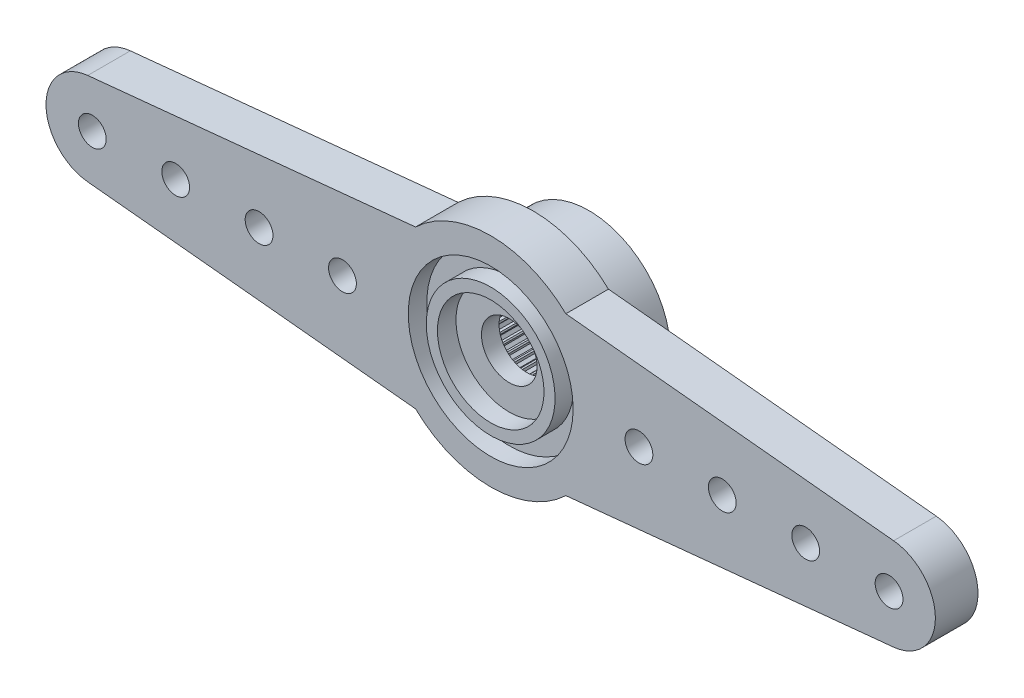
from build123d import *

# Parameters (mm, degrees)
BOSS_EXTRU_1_DEPTH      = 2.3
ESQUISSE2_R             = 4.45
ENL_V_MAT_EXTRU_1_DEPTH = 1
ESQUISSE3_R             = 3.475
ESQUISSE3_R_2           = 2.875
BOSS_EXTRU_2_DEPTH      = 1
ESQUISSE4_R             = 4.4
BOSS_EXTRU_3_DEPTH      = 3
ESQUISSE5_R             = 1.5
ENL_V_MAT_EXTRU_2_DEPTH = 26.079984549
ENL_V_START             = -3.35
ESQUISSE6_R             = 1.5
ENL_V_MAT_EXTRU_3_DEPTH = 3.35
ESQUISSE7_R             = 0.75
ENL_V_MAT_EXTRU_4_DEPTH = 3.35


with BuildPart() as part:
    # Esquisse1 → Boss.-Extru.1 (new body)
    with BuildSketch(Plane.XY):
        with BuildLine():
            Line((-21.747806415, 2.487688079), (-4.056245185, 4.25))
            ThreePointArc((-4.056245185, 4.25), (0, 5.875), (4.056245185, 4.25))
            Line((4.056245185, 4.25), (21.747806415, 2.487688079))
            ThreePointArc((21.747806415, 2.487688079), (24, 0), (21.747806415, -2.487688079))
            Line((21.747806415, -2.487688079), (4.056245185, -4.25))
            ThreePointArc((4.056245185, -4.25), (0, -5.875), (-4.056245185, -4.25))
            Line((-4.056245185, -4.25), (-21.747806415, -2.487688079))
            ThreePointArc((-21.747806415, -2.487688079), (-24, 0), (-21.747806415, 2.487688079))
        make_face()
    extrude(amount=BOSS_EXTRU_1_DEPTH)

    # Esquisse2 → Enlèv. mat.-Extru.1 (cut)
    with BuildSketch(Plane.XY.offset(2.3)):
        Circle(ESQUISSE2_R)
    extrude(amount=-ENL_V_MAT_EXTRU_1_DEPTH, mode=Mode.SUBTRACT)

    # Esquisse3 → Boss.-Extru.2 (add)
    with BuildSketch(Plane.XY.offset(1.3)):
        with Locations(Location((0, 0, 0), (0, 0, 180))):
            Circle(ESQUISSE3_R)
        with Locations(Location((0, 0, 0), (0, 0, 180))):
            Circle(ESQUISSE3_R_2, mode=Mode.SUBTRACT)
    extrude(amount=BOSS_EXTRU_2_DEPTH)

    # Esquisse4 → Boss.-Extru.3 (add)
    with BuildSketch(Plane(origin=(0, 0, 0), x_dir=(-1, 0, 0), z_dir=(0, 0, -1))):
        Circle(ESQUISSE4_R)
    extrude(amount=BOSS_EXTRU_3_DEPTH)

    # Esquisse5 → Enlèv. mat.-Extru.2 (cut, through all)
    with BuildSketch(Plane.XY.offset(1.3)):
        Circle(ESQUISSE5_R)
    extrude(amount=-ENL_V_MAT_EXTRU_2_DEPTH, mode=Mode.SUBTRACT)

    # Esquisse6 → Enlèv. mat.-Extru.3 (cut)
    with BuildSketch(Plane(origin=(0, 0, -3), x_dir=(-1, 0, 0), z_dir=(0, 0, -1)).offset(ENL_V_START)):
        with BuildLine():
            Line((-0.040605305, 2.865160176), (-0.114276657, 2.997822684))
            ThreePointArc((-0.114276657, 2.997822684), (-0.209269421, 2.992692151), (-0.304051754, 2.984552317))
            Line((-0.304051754, 2.984552317), (-0.35854309, 2.8429278))
            Line((-0.35854309, 2.8429278), (-0.438963363, 2.831625467))
            Line((-0.438963363, 2.831625467), (-0.530380804, 2.952743843))
            ThreePointArc((-0.530380804, 2.952743843), (-0.623735072, 2.934442802), (-0.716462144, 2.913191033))
            Line((-0.716462144, 2.913191033), (-0.750712851, 2.765361068))
            Line((-0.750712851, 2.765361068), (-0.828777499, 2.742976391))
            Line((-0.828777499, 2.742976391), (-0.936161691, 2.850193202))
            ThreePointArc((-0.936161691, 2.850193202), (-1.02606043, 2.819077862), (-1.114927414, 2.7851278))
            Line((-1.114927414, 2.7851278), (-1.12827084, 2.633969729))
            Line((-1.12827084, 2.633969729), (-1.202460424, 2.600938398))
            Line((-1.202460424, 2.600938398), (-1.323721256, 2.692166792))
            ThreePointArc((-1.323721256, 2.692166792), (-1.408414688, 2.648842779), (-1.491691889, 2.602855222))
            Line((-1.491691889, 2.602855222), (-1.483868321, 2.451311165))
            Line((-1.483868321, 2.451311165), (-1.552738824, 2.408276099))
            Line((-1.552738824, 2.408276099), (-1.685516093, 2.481740418))
            ThreePointArc((-1.685516093, 2.481740418), (-1.763355757, 2.427050983), (-1.839422279, 2.369921028))
            Line((-1.839422279, 2.369921028), (-1.810583992, 2.220940618))
            Line((-1.810583992, 2.220940618), (-1.872794929, 2.168739444))
            Line((-1.872794929, 2.168739444), (-2.014504276, 2.223009789))
            ThreePointArc((-2.014504276, 2.223009789), (-2.083975111, 2.158019401), (-2.151350406, 2.090859017))
            Line((-2.151350406, 2.090859017), (-2.102058706, 1.947341988))
            Line((-2.102058706, 1.947341988), (-2.156399211, 1.886990743))
            Line((-2.156399211, 1.886990743), (-2.304282424, 1.921010804))
            ThreePointArc((-2.304282424, 1.921010804), (-2.364032261, 1.846984426), (-2.421404945, 1.771100813))
            Line((-2.421404945, 1.771100813), (-2.352619239, 1.635840561))
            Line((-2.352619239, 1.635840561), (-2.398031635, 1.568513914))
            Line((-2.398031635, 1.568513914), (-2.549210337, 1.581621528))
            ThreePointArc((-2.549210337, 1.581621528), (-2.598076211, 1.5), (-2.644329591, 1.416870147))
            Line((-2.644329591, 1.416870147), (-2.557388713, 1.292499358))
            Line((-2.557388713, 1.292499358), (-2.592989102, 1.219507746))
            Line((-2.592989102, 1.219507746), (-2.74452077, 1.211447789))
            ThreePointArc((-2.74452077, 1.211447789), (-2.781551564, 1.12381978), (-2.815785369, 1.035061715))
            Line((-2.815785369, 1.035061715), (-2.712381526, 0.924001126))
            Line((-2.712381526, 0.924001126), (-2.737476984, 0.846765246))
            Line((-2.737476984, 0.846765246), (-2.886412228, 0.817694596))
            ThreePointArc((-2.886412228, 0.817694596), (-2.910887179, 0.725765687), (-2.932435088, 0.633106984))
            Line((-2.932435088, 0.633106984), (-2.814580917, 0.537518262))
            Line((-2.814580917, 0.537518262), (-2.828682992, 0.457541424))
            Line((-2.828682992, 0.457541424), (-2.972122955, 0.408025908))
            ThreePointArc((-2.972122955, 0.408025908), (-2.983565686, 0.31358539), (-2.992008294, 0.218829546))
            Line((-2.992008294, 0.218829546), (-2.861997693, 0.140573217))
            Line((-2.861997693, 0.140573217), (-2.864831902, 0.059412079))
            Line((-2.864831902, 0.059412079), (-2.999984689, -0.00958454))
            ThreePointArc((-2.999984689, -0.00958454), (-2.998172481, -0.10469849), (-2.993345461, -0.19970716))
            Line((-2.993345461, -0.19970716), (-2.853708938, -0.259107925))
            Line((-2.853708938, -0.259107925), (-2.845220118, -0.339873655))
            Line((-2.845220118, -0.339873655), (-2.969455134, -0.427008436))
            ThreePointArc((-2.969455134, -0.427008436), (-2.954423259, -0.520944533), (-2.936420564, -0.614356794))
            Line((-2.936420564, -0.614356794), (-2.789875986, -0.653745827))
            Line((-2.789875986, -0.653745827), (-2.770229361, -0.732544135))
            Line((-2.770229361, -0.732544135), (-2.881128513, -0.836121099))
            ThreePointArc((-2.881128513, -0.836121099), (-2.853169549, -0.927050983), (-2.822341581, -1.017048672))
            Line((-2.822341581, -1.017048672), (-2.67174127, -1.03565931))
            Line((-2.67174127, -1.03565931), (-2.641319241, -1.110956476))
            Line((-2.641319241, -1.110956476), (-2.736724002, -1.228959615))
            ThreePointArc((-2.736724002, -1.228959615), (-2.696382139, -1.31511344), (-2.653328929, -1.399944854))
            Line((-2.653328929, -1.399944854), (-2.50160415, -1.397414862))
            Line((-2.50160415, -1.397414862), (-2.460998845, -1.467745313))
            Line((-2.460998845, -1.467745313), (-2.539052272, -1.59787783))
            ThreePointArc((-2.539052272, -1.59787783), (-2.487112718, -1.67757871), (-2.432672248, -1.755592702))
            Line((-2.432672248, -1.755592702), (-2.282776151, -1.731971324))
            Line((-2.282776151, -1.731971324), (-2.232777907, -1.795966158))
            Line((-2.232777907, -1.795966158), (-2.291960777, -1.935695171))
            ThreePointArc((-2.291960777, -1.935695171), (-2.229434476, -2.007391819), (-2.164666369, -2.077069935))
            Line((-2.164666369, -2.077069935), (-2.019516511, -2.032816934))
            Line((-2.019516511, -2.032816934), (-1.961098487, -2.089230564))
            Line((-1.961098487, -2.089230564), (-2.000258873, -2.235836408))
            ThreePointArc((-2.000258873, -2.235836408), (-1.928362829, -2.298133329), (-1.854527721, -2.358119364))
            Line((-1.854527721, -2.358119364), (-1.716949278, -2.294096074))
            Line((-1.716949278, -2.294096074), (-1.651248515, -2.341830473))
            Line((-1.651248515, -2.341830473), (-1.669624205, -2.492459631))
            ThreePointArc((-1.669624205, -2.492459631), (-1.589757793, -2.544144288), (-1.5082928, -2.593270682))
            Line((-1.5082928, -2.593270682), (-1.380963581, -2.510723244))
            Line((-1.380963581, -2.510723244), (-1.309258869, -2.548849316))
            Line((-1.309258869, -2.548849316), (-1.306492201, -2.700569964))
            ThreePointArc((-1.306492201, -2.700569964), (-1.220209929, -2.740636373), (-1.132700676, -2.777946936))
            Line((-1.132700676, -2.777946936), (-1.018098999, -2.678482042))
            Line((-1.018098999, -2.678482042), (-0.941785989, -2.706257707))
            Line((-0.941785989, -2.706257707), (-0.917930812, -2.856116773))
            ThreePointArc((-0.917930812, -2.856116773), (-0.826912067, -2.883785088), (-0.735061821, -2.908553613))
            Line((-0.735061821, -2.908553613), (-0.635418278, -2.794107234))
            Line((-0.635418278, -2.794107234), (-0.555982315, -2.810991869))
            Line((-0.555982315, -2.810991869), (-0.511502945, -2.956072519))
            ThreePointArc((-0.511502945, -2.956072519), (-0.417519303, -2.970804206), (-0.323115824, -2.982548602))
            Line((-0.323115824, -2.982548602), (-0.240369863, -2.855348306))
            Line((-0.240369863, -2.855348306), (-0.159357078, -2.861013272))
            Line((-0.159357078, -2.861013272), (-0.095119254, -2.998491675))
            ThreePointArc((-0.095119254, -2.998491675), (0, -3), (0.095119254, -2.998491675))
            Line((0.095119254, -2.998491675), (0.159357078, -2.861013272))
            Line((0.159357078, -2.861013272), (0.240369863, -2.855348306))
            Line((0.240369863, -2.855348306), (0.323115824, -2.982548602))
            ThreePointArc((0.323115824, -2.982548602), (0.417519303, -2.970804206), (0.511502945, -2.956072519))
            Line((0.511502945, -2.956072519), (0.555982315, -2.810991869))
            Line((0.555982315, -2.810991869), (0.635418278, -2.794107234))
            Line((0.635418278, -2.794107234), (0.735061821, -2.908553613))
            ThreePointArc((0.735061821, -2.908553613), (0.826912067, -2.883785088), (0.917930812, -2.856116773))
            Line((0.917930812, -2.856116773), (0.941785989, -2.706257707))
            Line((0.941785989, -2.706257707), (1.018098999, -2.678482042))
            Line((1.018098999, -2.678482042), (1.132700676, -2.777946936))
            ThreePointArc((1.132700676, -2.777946936), (1.220209929, -2.740636373), (1.306492201, -2.700569964))
            Line((1.306492201, -2.700569964), (1.309258869, -2.548849316))
            Line((1.309258869, -2.548849316), (1.380963581, -2.510723244))
            Line((1.380963581, -2.510723244), (1.5082928, -2.593270682))
            ThreePointArc((1.5082928, -2.593270682), (1.589757793, -2.544144288), (1.669624205, -2.492459631))
            Line((1.669624205, -2.492459631), (1.651248515, -2.341830473))
            Line((1.651248515, -2.341830473), (1.716949278, -2.294096074))
            Line((1.716949278, -2.294096074), (1.854527721, -2.358119364))
            ThreePointArc((1.854527721, -2.358119364), (1.928362829, -2.298133329), (2.000258873, -2.235836408))
            Line((2.000258873, -2.235836408), (1.961098487, -2.089230564))
            Line((1.961098487, -2.089230564), (2.019516511, -2.032816934))
            Line((2.019516511, -2.032816934), (2.164666369, -2.077069935))
            ThreePointArc((2.164666369, -2.077069935), (2.229434476, -2.007391819), (2.291960777, -1.935695171))
            Line((2.291960777, -1.935695171), (2.232777907, -1.795966158))
            Line((2.232777907, -1.795966158), (2.282776151, -1.731971324))
            Line((2.282776151, -1.731971324), (2.432672248, -1.755592702))
            ThreePointArc((2.432672248, -1.755592702), (2.487112718, -1.67757871), (2.539052272, -1.59787783))
            Line((2.539052272, -1.59787783), (2.460998845, -1.467745313))
            Line((2.460998845, -1.467745313), (2.50160415, -1.397414862))
            Line((2.50160415, -1.397414862), (2.653328929, -1.399944854))
            ThreePointArc((2.653328929, -1.399944854), (2.696382139, -1.31511344), (2.736724002, -1.228959615))
            Line((2.736724002, -1.228959615), (2.641319241, -1.110956476))
            Line((2.641319241, -1.110956476), (2.67174127, -1.03565931))
            Line((2.67174127, -1.03565931), (2.822341581, -1.017048672))
            ThreePointArc((2.822341581, -1.017048672), (2.853169549, -0.927050983), (2.881128513, -0.836121099))
            Line((2.881128513, -0.836121099), (2.770229361, -0.732544135))
            Line((2.770229361, -0.732544135), (2.789875986, -0.653745827))
            Line((2.789875986, -0.653745827), (2.936420564, -0.614356794))
            ThreePointArc((2.936420564, -0.614356794), (2.954423259, -0.520944533), (2.969455134, -0.427008436))
            Line((2.969455134, -0.427008436), (2.845220118, -0.339873655))
            Line((2.845220118, -0.339873655), (2.853708938, -0.259107925))
            Line((2.853708938, -0.259107925), (2.993345461, -0.19970716))
            ThreePointArc((2.993345461, -0.19970716), (2.998172481, -0.10469849), (2.999984689, -0.00958454))
            Line((2.999984689, -0.00958454), (2.864831902, 0.059412079))
            Line((2.864831902, 0.059412079), (2.861997693, 0.140573217))
            Line((2.861997693, 0.140573217), (2.992008294, 0.218829546))
            ThreePointArc((2.992008294, 0.218829546), (2.983565686, 0.31358539), (2.972122955, 0.408025908))
            Line((2.972122955, 0.408025908), (2.828682992, 0.457541424))
            Line((2.828682992, 0.457541424), (2.814580917, 0.537518262))
            Line((2.814580917, 0.537518262), (2.932435088, 0.633106984))
            ThreePointArc((2.932435088, 0.633106984), (2.910887179, 0.725765687), (2.886412228, 0.817694596))
            Line((2.886412228, 0.817694596), (2.737476984, 0.846765246))
            Line((2.737476984, 0.846765246), (2.712381526, 0.924001126))
            Line((2.712381526, 0.924001126), (2.815785369, 1.035061715))
            ThreePointArc((2.815785369, 1.035061715), (2.781551564, 1.12381978), (2.74452077, 1.211447789))
            Line((2.74452077, 1.211447789), (2.592989102, 1.219507746))
            Line((2.592989102, 1.219507746), (2.557388713, 1.292499358))
            Line((2.557388713, 1.292499358), (2.644329591, 1.416870147))
            ThreePointArc((2.644329591, 1.416870147), (2.598076211, 1.5), (2.549210337, 1.581621528))
            Line((2.549210337, 1.581621528), (2.398031635, 1.568513914))
            Line((2.398031635, 1.568513914), (2.352619239, 1.635840561))
            Line((2.352619239, 1.635840561), (2.421404945, 1.771100813))
            ThreePointArc((2.421404945, 1.771100813), (2.364032261, 1.846984426), (2.304282424, 1.921010804))
            Line((2.304282424, 1.921010804), (2.156399211, 1.886990743))
            Line((2.156399211, 1.886990743), (2.102058706, 1.947341988))
            Line((2.102058706, 1.947341988), (2.151350406, 2.090859017))
            ThreePointArc((2.151350406, 2.090859017), (2.083975111, 2.158019401), (2.014504276, 2.223009789))
            Line((2.014504276, 2.223009789), (1.872794929, 2.168739444))
            Line((1.872794929, 2.168739444), (1.810583992, 2.220940618))
            Line((1.810583992, 2.220940618), (1.839422279, 2.369921028))
            ThreePointArc((1.839422279, 2.369921028), (1.763355757, 2.427050983), (1.685516093, 2.481740418))
            Line((1.685516093, 2.481740418), (1.552738824, 2.408276099))
            Line((1.552738824, 2.408276099), (1.483868321, 2.451311165))
            Line((1.483868321, 2.451311165), (1.491691889, 2.602855222))
            ThreePointArc((1.491691889, 2.602855222), (1.408414688, 2.648842779), (1.323721256, 2.692166792))
            Line((1.323721256, 2.692166792), (1.202460424, 2.600938398))
            Line((1.202460424, 2.600938398), (1.12827084, 2.633969729))
            Line((1.12827084, 2.633969729), (1.114927414, 2.7851278))
            ThreePointArc((1.114927414, 2.7851278), (1.02606043, 2.819077862), (0.936161691, 2.850193202))
            Line((0.936161691, 2.850193202), (0.828777499, 2.742976391))
            Line((0.828777499, 2.742976391), (0.750712851, 2.765361068))
            Line((0.750712851, 2.765361068), (0.716462144, 2.913191033))
            ThreePointArc((0.716462144, 2.913191033), (0.623735072, 2.934442802), (0.530380804, 2.952743843))
            Line((0.530380804, 2.952743843), (0.438963363, 2.831625467))
            Line((0.438963363, 2.831625467), (0.35854309, 2.8429278))
            Line((0.35854309, 2.8429278), (0.304051754, 2.984552317))
            ThreePointArc((0.304051754, 2.984552317), (0.209269421, 2.992692151), (0.114276657, 2.997822684))
            Line((0.114276657, 2.997822684), (0.040605305, 2.865160176))
            Line((0.040605305, 2.865160176), (-0.040605305, 2.865160176))
        make_face()
        with Locations(Location((0, 0, 0), (0, 0, 180))):
            Circle(ESQUISSE6_R, mode=Mode.SUBTRACT)
    extrude(amount=ENL_V_MAT_EXTRU_3_DEPTH, mode=Mode.SUBTRACT)

    # Esquisse7 → Enlèv. mat.-Extru.4 (cut)
    with BuildSketch(Plane.XY.offset(2.3)):
        with Locations((-21.5, 0)):
            Circle(ESQUISSE7_R)
        with Locations((-17, 0)):
            Circle(ESQUISSE7_R)
        with Locations((-12.5, 0)):
            Circle(ESQUISSE7_R)
        with Locations((-8, 0)):
            Circle(ESQUISSE7_R)
        with Locations(Location((8, 0, 0), (0, 0, 180))):
            Circle(ESQUISSE7_R)
        with Locations(Location((12.5, 0, 0), (0, 0, 180))):
            Circle(ESQUISSE7_R)
        with Locations(Location((17, 0, 0), (0, 0, 180))):
            Circle(ESQUISSE7_R)
        with Locations(Location((21.5, 0, 0), (0, 0, 180))):
            Circle(ESQUISSE7_R)
    extrude(amount=-ENL_V_MAT_EXTRU_4_DEPTH, mode=Mode.SUBTRACT)


solid = part.part
